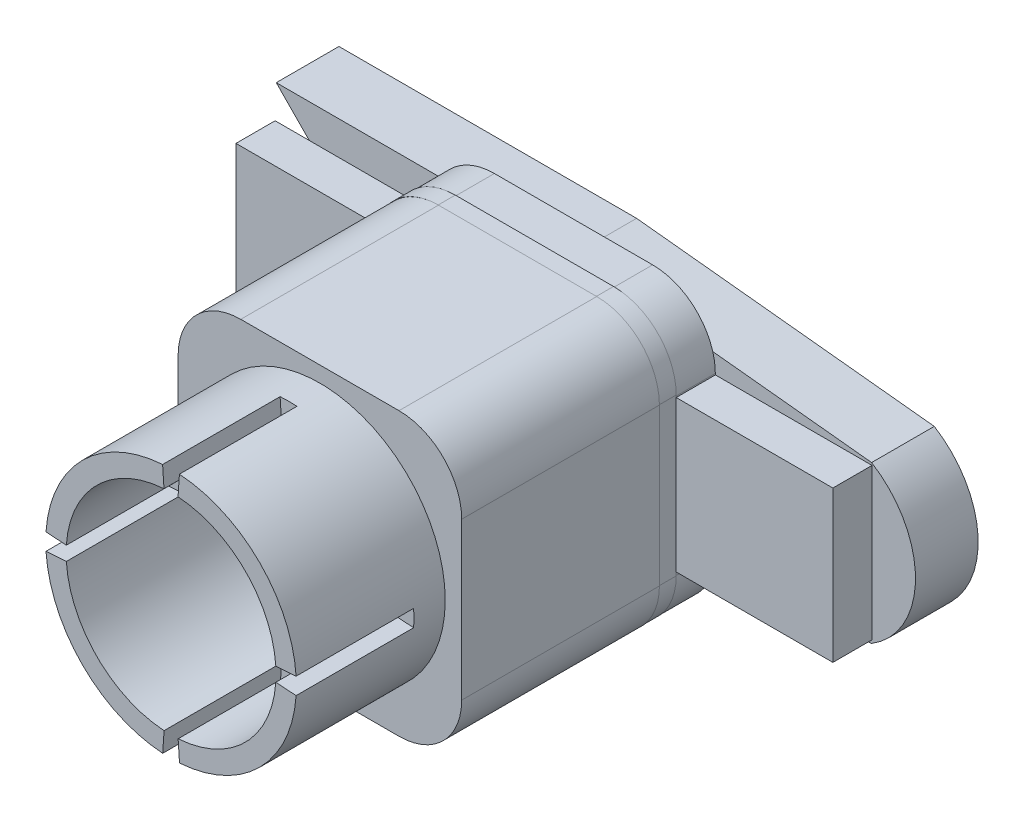
from build123d import *

# Parameters (mm, degrees)
BOSS_EXTRUDE1_DEPTH = 2
BOSS_EXTRUDE2_DEPTH = 11.02
BOSS_EXTRUDE3_DEPTH = 1.6
SKETCH4_R           = 8
BOSS_EXTRUDE4_DEPTH = 9.5
SKETCH5_R           = 6.65
CUT_EXTRUDE1_DEPTH  = 20
BOSS_EXTRUDE5_DEPTH = 1.095
SKETCH13_R          = 6.7
CUT_EXTRUDE3_DEPTH  = 30
CUT_EXTRUDE4_DEPTH  = 7.5
CIRPATTERN2_COUNT   = 4
BOSS_EXTRUDE6_DEPTH = 2.5
BOSS_EXTRUDE7_DEPTH = 4


with BuildPart() as part:
    # Sketch1 → Boss-Extrude1 (new body)
    with BuildSketch(Plane.XY):
        with BuildLine():
            Line((-5.05, 9.000108401), (5.05, 9.000108401))
            ThreePointArc((5.05, 9.000108401), (7.878427125, 7.828535526), (9.05, 5.000108401))
            Line((9.05, 5.000108401), (9.05, -5.000108401))
            ThreePointArc((9.05, -5.000108401), (7.878427125, -7.828535526), (5.05, -9.000108401))
            Line((5.05, -9.000108401), (-5.05, -9.000108401))
            ThreePointArc((-5.05, -9.000108401), (-7.878427125, -7.828535526), (-9.05, -5.000108401))
            Line((-9.05, -5.000108401), (-9.05, 5.000108401))
            ThreePointArc((-9.05, 5.000108401), (-7.878427125, 7.828535526), (-5.05, 9.000108401))
        make_face()
    extrude(amount=BOSS_EXTRUDE1_DEPTH)

    # Sketch2 → Boss-Extrude2 (add)
    with BuildSketch(Plane.XY):
        with BuildLine():
            Line((-5.05, 9.000108401), (5.05, 9.000108401))
            ThreePointArc((5.05, 9.000108401), (7.878427125, 7.828535526), (9.05, 5.000108401))
            Line((9.05, 5.000108401), (9.05, -5.000108401))
            ThreePointArc((9.05, -5.000108401), (7.878427125, -7.828535526), (5.05, -9.000108401))
            Line((5.05, -9.000108401), (-5.05, -9.000108401))
            ThreePointArc((-5.05, -9.000108401), (-7.878427125, -7.828535526), (-9.05, -5.000108401))
            Line((-9.05, -5.000108401), (-9.05, 5.000108401))
            ThreePointArc((-9.05, 5.000108401), (-7.878427125, 7.828535526), (-5.05, 9.000108401))
        make_face()
    extrude(amount=BOSS_EXTRUDE2_DEPTH)

    # Sketch3 → Boss-Extrude3 (add)
    with BuildSketch(Plane.XY.offset(11.02)):
        with BuildLine():
            Line((-5.05, 9.000108401), (5.05, 9.000108401))
            ThreePointArc((5.05, 9.000108401), (7.878427125, 7.828535526), (9.05, 5.000108401))
            Line((9.05, 5.000108401), (9.05, -5.000108401))
            ThreePointArc((9.05, -5.000108401), (7.878427125, -7.828535526), (5.05, -9.000108401))
            Line((5.05, -9.000108401), (-5.05, -9.000108401))
            ThreePointArc((-5.05, -9.000108401), (-7.878427125, -7.828535526), (-9.05, -5.000108401))
            Line((-9.05, -5.000108401), (-9.05, 5.000108401))
            ThreePointArc((-9.05, 5.000108401), (-7.878427125, 7.828535526), (-5.05, 9.000108401))
        make_face()
    extrude(amount=BOSS_EXTRUDE3_DEPTH)

    # Sketch4 → Boss-Extrude4 (add)
    with BuildSketch(Plane.XY.offset(12.62)):
        Circle(SKETCH4_R)
    extrude(amount=BOSS_EXTRUDE4_DEPTH)

    # Sketch5 → Cut-Extrude1 (cut)
    with BuildSketch(Plane.XY.offset(12.62)):
        Circle(SKETCH5_R)
    extrude(amount=CUT_EXTRUDE1_DEPTH, mode=Mode.SUBTRACT)

    # Sketch12 → Boss-Extrude5 (add)
    with BuildSketch(Plane(origin=(0, 0, 0), x_dir=(-1, 0, 0), z_dir=(0, 0, -1))):
        with BuildLine():
            Line((-5.027404416, 8.997340309), (5.072595584, 8.997340309))
            ThreePointArc((5.072595584, 8.997340309), (7.901022709, 7.825767433), (9.072595584, 4.997340309))
            Line((9.072595584, 4.997340309), (9.072595584, -5.002876493))
            ThreePointArc((9.072595584, -5.002876493), (7.901022709, -7.831303618), (5.072595584, -9.002876493))
            Line((5.072595584, -9.002876493), (-5.027404416, -9.002876493))
            ThreePointArc((-5.027404416, -9.002876493), (-7.85583154, -7.831303618), (-9.027404416, -5.002876493))
            Line((-9.027404416, -5.002876493), (-9.027404416, 4.997340309))
            ThreePointArc((-9.027404416, 4.997340309), (-7.85583154, 7.825767433), (-5.027404416, 8.997340309))
        make_face()
    extrude(amount=BOSS_EXTRUDE5_DEPTH)

    # Sketch13 → Cut-Extrude3 (cut, symmetric)
    with BuildSketch(Plane.XY):
        Circle(SKETCH13_R)
    extrude(amount=CUT_EXTRUDE3_DEPTH, both=True, mode=Mode.SUBTRACT)

    # Sketch15 → Cut-Extrude4 (cut)
    with BuildSketch(Plane.XY.offset(22.12)):
        Polygon((-0.552830798, 8.187091014), (-0.002830798, 0.003314653), (0.547169202, 8.187091014), (0.617169202, 9.000108401), (-0.626042329, 9.000108401), align=None)
    cut_extrude4 = extrude(amount=-CUT_EXTRUDE4_DEPTH, mode=Mode.SUBTRACT)

    # CirPattern2: Cut-Extrude4 ×4 about axis
    cirpattern2_axis = Axis((0, 0, 0), (0, 0, 1))
    for i in range(1, CIRPATTERN2_COUNT):
        add(cut_extrude4.rotate(cirpattern2_axis, i * 360 / CIRPATTERN2_COUNT), mode=Mode.SUBTRACT)


with BuildPart() as body_2:
    # Sketch16 → Boss-Extrude6 (new body)
    with BuildSketch(Plane(origin=(0, 0, -1.095), x_dir=(-1, 0, 0), z_dir=(0, 0, -1))):
        with BuildLine():
            Line((-5.0235757, 8.939451881), (5.076696464, 8.939451881))
            ThreePointArc((5.076696464, 8.939451881), (7.905123589, 7.767879006), (9.076696464, 4.939451881))
            Line((9.076696464, 4.939451881), (9.072595584, 4.856889481))
            Line((9.072595584, 4.856889481), (19.072595584, 4.856889481))
            Line((19.072595584, 4.856889481), (19.072595584, -4.825488195))
            Line((19.072595584, -4.825488195), (9.072595584, -4.825488195))
            Line((9.072595584, -4.825488195), (9.076550984, -4.98570964))
            ThreePointArc((9.076550984, -4.98570964), (7.907149741, -7.818099531), (5.076555683, -8.991841001))
            Line((5.076555683, -8.991841001), (-5.023434919, -8.991841001))
            ThreePointArc((-5.023434919, -8.991841001), (-7.854028977, -7.818099531), (-9.02343022, -4.98570964))
            Line((-9.02343022, -4.98570964), (-9.027404416, -4.784110513))
            Line((-9.027404416, -4.784110513), (-19.027404416, -4.784110513))
            Line((-19.027404416, -4.784110513), (-19.027404416, 4.856889481))
            Line((-19.027404416, 4.856889481), (-9.027404416, 4.856889481))
            Line((-9.027404416, 4.856889481), (-9.0235757, 4.939451881))
            ThreePointArc((-9.0235757, 4.939451881), (-7.852002825, 7.767879006), (-5.0235757, 8.939451881))
        make_face()
    extrude(amount=BOSS_EXTRUDE6_DEPTH)

    # Sketch17 → Boss-Extrude7 (add)
    with BuildSketch(Plane(origin=(0, 0, -3.595), x_dir=(-1, 0, 0), z_dir=(0, 0, -1))):
        with BuildLine():
            Line((0, 7), (-19, 5))
            ThreePointArc((-19, 5), (-21.800833997, 0), (-19, -5))
            Line((-19, -5), (0, -7))
            Line((0, -7), (19, -7))
            Line((19, -7), (16, -3.95))
            Line((16, -3.95), (0, -3.7))
            Line((0, -3.7), (-16, -2.2))
            ThreePointArc((-16, -2.2), (-17.416609195, 0), (-16, 2.2))
            Line((-16, 2.2), (0, 3.7))
            Line((0, 3.7), (16, 3.95))
            Line((16, 3.95), (19, 7))
            Line((19, 7), (0, 7))
        make_face()
    extrude(amount=BOSS_EXTRUDE7_DEPTH)


solid = Compound([part.part, body_2.part])
